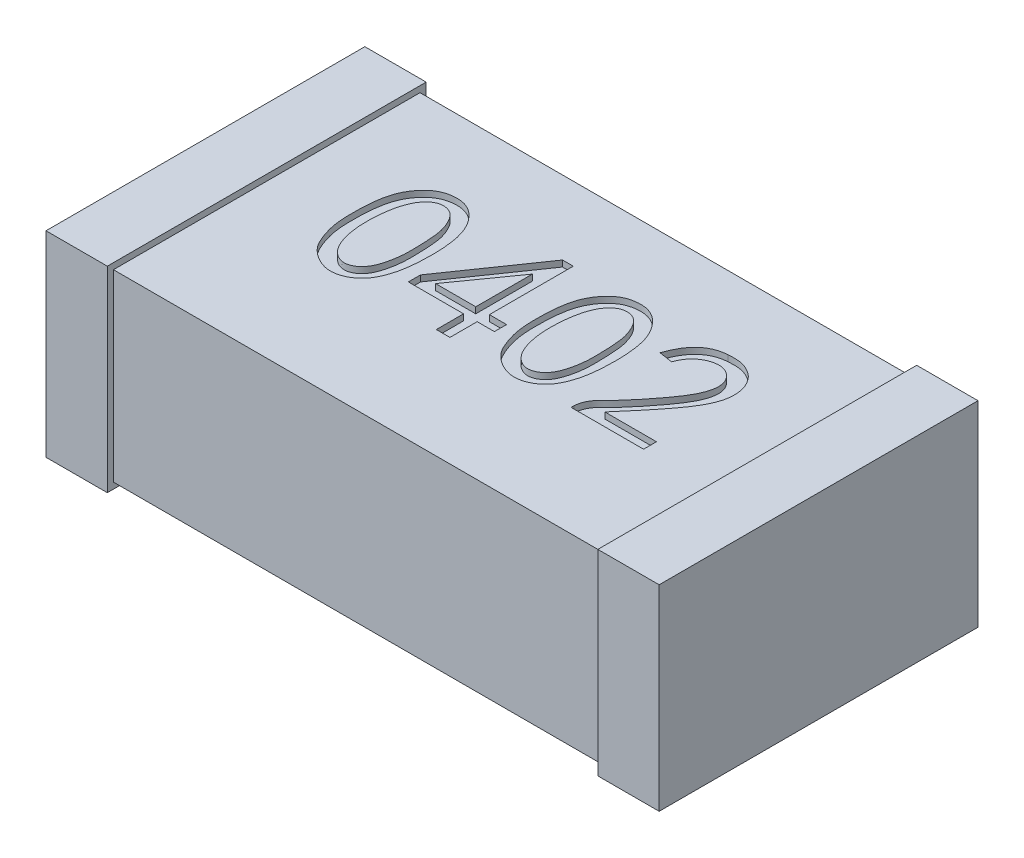
from build123d import *

# Parameters (mm, degrees)
SKETCH_1_W          = 1
SKETCH_1_H          = 0.5
EXTRUDE_1_DEPTH     = 0.3
SKETCH_2_W          = 0.52
SKETCH_2_H          = 0.32
EXTRUDE_2_DEPTH     = 0.1
SKETCH_3_W          = 0.52
SKETCH_3_H          = 0.32
EXTRUDE_3_DEPTH     = 0.1
CUT_EXTRUDE_1_DEPTH = 0.01


with BuildPart() as part:
    # 草图1 → 凸台-拉伸1 (new body)
    with BuildSketch(Plane(origin=(0, 0, 0), x_dir=(1, 0, 0), z_dir=(0, 1, 0))):
        Rectangle(SKETCH_1_W, SKETCH_1_H)
    extrude(amount=EXTRUDE_1_DEPTH)

    # 草图2 → 凸台-拉伸2 (add)
    with BuildSketch(Plane.ZY.offset(0.5)):
        with Locations((0, 0.15)):
            Rectangle(SKETCH_2_W, SKETCH_2_H)
    extrude(amount=-EXTRUDE_2_DEPTH)

    # 草图3 → 凸台-拉伸3 (add)
    with BuildSketch(Plane(origin=(0.5, 0, 0), x_dir=(0, 0, -1), z_dir=(1, 0, 0))):
        with Locations((0, 0.15)):
            Rectangle(SKETCH_3_W, SKETCH_3_H)
    extrude(amount=-EXTRUDE_3_DEPTH)

    # 草图4 → 切除-拉伸1 (cut)
    # profile 1 of 4: a face of its own
    with BuildSketch(Plane(origin=(0, 0.3, 0), x_dir=(1, 0, 0), z_dir=(0, 1, 0))):
        with BuildLine():
            add(Edge.make_bspline(
                [(-0.28495391, 0.040429461), (-0.284842534, 0.042943088), (-0.284625306, 0.047845698), (-0.283997688, 0.054994256), (-0.283239775, 0.061759764), (-0.282254388, 0.068121531), (-0.2810365, 0.074058383), (-0.279658, 0.079601433), (-0.278064926, 0.084735172), (-0.275719159, 0.09100497), (-0.272201568, 0.098221433), (-0.26717004, 0.106152841), (-0.261323237, 0.11328262), (-0.255791975, 0.118506843), (-0.250995997, 0.122183675), (-0.247164102, 0.124570922), (-0.243138334, 0.126610646), (-0.23890549, 0.128274084), (-0.234473356, 0.129513184), (-0.229853673, 0.130427999), (-0.225031193, 0.130993918), (-0.220061865, 0.131162285), (-0.215055093, 0.13092654), (-0.210136656, 0.130158548), (-0.20539045, 0.128795165), (-0.200813235, 0.126923456), (-0.196417467, 0.124518541), (-0.192181018, 0.121599739), (-0.188154114, 0.118091566), (-0.184286565, 0.11413647), (-0.180674162, 0.109783572), (-0.177365208, 0.10511688), (-0.174373449, 0.10018453), (-0.171738764, 0.094959463), (-0.169377081, 0.089487753), (-0.16739584, 0.083720661), (-0.165756704, 0.077681618), (-0.163951759, 0.069150411), (-0.162363798, 0.057833986), (-0.16124506, 0.043511718), (-0.160989781, 0.028240169), (-0.161369896, 0.015033405), (-0.162086421, 0.00433288), (-0.162901031, -0.003428344), (-0.163995193, -0.010794052), (-0.165268928, -0.017800095), (-0.166862448, -0.024409217), (-0.168750785, -0.030628498), (-0.17079105, -0.036498568), (-0.173192551, -0.041957722), (-0.175808163, -0.047052323), (-0.178790184, -0.051717111), (-0.182020787, -0.056015095), (-0.185585612, -0.059912214), (-0.189531103, -0.063329966), (-0.193719991, -0.06643327), (-0.198264771, -0.06907453), (-0.203044338, -0.071315897), (-0.207966932, -0.07309974), (-0.212971097, -0.074262395), (-0.217962432, -0.074953431), (-0.222976111, -0.074955959), (-0.227982428, -0.074520043), (-0.232960824, -0.07337334), (-0.237972706, -0.071796748), (-0.242883828, -0.069567148), (-0.247610668, -0.066999875), (-0.252059884, -0.064236719), (-0.256109885, -0.061230008), (-0.259793032, -0.058019089), (-0.263155271, -0.054630921), (-0.266156922, -0.051033338), (-0.268766829, -0.04721638), (-0.271683353, -0.041844519), (-0.274807882, -0.034915468), (-0.278041751, -0.026380543), (-0.280684804, -0.01764032), (-0.282384341, -0.010129395), (-0.283504843, -0.003845931), (-0.284121346, 0.001304946), (-0.284656871, 0.006849661), (-0.284980527, 0.012789508), (-0.285195813, 0.019129637), (-0.285289508, 0.025874563), (-0.285189223, 0.033023502), (-0.285033733, 0.037917224), (-0.28495391, 0.040429461)],
                knots=[0, 0, 0, 0, 1.18043416, 2.302333746, 3.366253517, 4.374302266, 5.321670991, 6.208995316, 7.053297808, 7.84229274, 9.348259463, 10.810477328, 12.240076564, 13.663562249, 14.3695339, 15.072606272, 15.778577923, 16.484387009, 17.202829605, 17.934942377, 18.692112664, 19.478485278, 20.265441384, 21.040673806, 21.808439453, 22.577161074, 23.356320991, 24.155029842, 24.986154494, 25.858111265, 26.748121484, 27.637306138, 28.540117759, 29.452135788, 30.380885827, 31.334339875, 32.310628684, 33.31521083, 35.42407972, 37.666773946, 40.052062172, 42.587025658, 43.863776122, 45.083322308, 46.247467896, 47.357025429, 48.423487632, 49.435172604, 50.405897663, 51.337337341, 52.231284254, 53.090220275, 53.931690991, 54.751583713, 55.562922169, 56.377338113, 57.194202079, 58.024663732, 58.851830165, 59.645552351, 60.431282623, 61.21044254, 61.99312915, 62.783838437, 63.60230231, 64.454612977, 65.309477934, 66.125301685, 66.909862715, 67.67340185, 68.415973016, 69.147238889, 69.868837108, 70.581506411, 72.0124375, 73.431838244, 74.861437481, 76.292961888, 77.042577341, 77.855187732, 78.726196438, 79.655959089, 80.645695907, 81.702690171, 82.820655125, 84, 84, 84, 84], degree=3))
        make_face()
        with BuildLine():
            add(Edge.make_bspline(
                [(-0.260392506, 0.047447005), (-0.260658041, 0.044806289), (-0.261181153, 0.039603987), (-0.261608995, 0.031886474), (-0.261730918, 0.024387426), (-0.261619269, 0.017103813), (-0.261188699, 0.010049884), (-0.260454073, 0.00321199), (-0.25940762, -0.003405071), (-0.258126854, -0.00978375), (-0.256592321, -0.015822097), (-0.254772487, -0.021438072), (-0.252701077, -0.026590764), (-0.250409612, -0.031287934), (-0.247894284, -0.03553519), (-0.245108254, -0.039308413), (-0.242129687, -0.042687874), (-0.238869569, -0.045527911), (-0.235525843, -0.047912928), (-0.232107256, -0.049766065), (-0.228669562, -0.051079198), (-0.225199642, -0.051882105), (-0.221710001, -0.052138468), (-0.218199248, -0.051890143), (-0.214693353, -0.051023425), (-0.21120973, -0.049695057), (-0.207848325, -0.047865476), (-0.204668318, -0.045656248), (-0.201736014, -0.043017958), (-0.199049862, -0.039978923), (-0.196625221, -0.036520345), (-0.194406719, -0.032701353), (-0.192458705, -0.028458603), (-0.190168009, -0.02224646), (-0.187861059, -0.01397355), (-0.185808628, -0.003635842), (-0.184598054, 0.00714504), (-0.184280654, 0.018206221), (-0.184487027, 0.029196872), (-0.184734546, 0.039843771), (-0.185329713, 0.04996702), (-0.186042011, 0.059618167), (-0.187250846, 0.068840302), (-0.189478567, 0.077585122), (-0.192598951, 0.085876339), (-0.195801688, 0.092421411), (-0.1988711, 0.097172396), (-0.201290789, 0.10036017), (-0.203980867, 0.103023938), (-0.206817398, 0.105294816), (-0.209866366, 0.107023682), (-0.213100198, 0.108316915), (-0.216517483, 0.109118342), (-0.220066431, 0.10951351), (-0.223641875, 0.109444429), (-0.227153824, 0.108816872), (-0.230560059, 0.107719361), (-0.233882012, 0.10615692), (-0.237049987, 0.1040422), (-0.24011462, 0.10145398), (-0.243041387, 0.098348677), (-0.245924442, 0.094810569), (-0.248554289, 0.090702135), (-0.250986432, 0.086099917), (-0.253143291, 0.080944783), (-0.255074981, 0.075266571), (-0.256809826, 0.069065587), (-0.25826848, 0.062338102), (-0.259478906, 0.055078753), (-0.260081031, 0.050048908), (-0.260392506, 0.047447005)],
                knots=[0, 0, 0, 0, 1.378198314, 2.715098627, 4.012594964, 5.272602849, 6.497213731, 7.681415101, 8.842769074, 9.975170128, 11.059162755, 12.076494648, 13.038717388, 13.940857576, 14.788360499, 15.598271168, 16.373595835, 17.122768248, 17.838466736, 18.502782022, 19.136468245, 19.744060339, 20.345653328, 20.947246317, 21.563841626, 22.214212994, 22.87852828, 23.546305104, 24.220743313, 24.921956094, 25.648106704, 26.41081768, 27.212668989, 28.069279432, 29.84713992, 31.666334073, 33.537864714, 35.473745168, 37.408579624, 39.246547954, 41.003985019, 42.674193204, 44.272363647, 45.827394737, 47.348405091, 48.867584295, 49.599750274, 50.283750763, 50.94125936, 51.560811542, 52.165388272, 52.754418158, 53.363720025, 53.982318455, 54.604903792, 55.213928724, 55.828148287, 56.458765578, 57.113918044, 57.800421407, 58.537638978, 59.326979919, 60.167286366, 61.066273245, 62.027297208, 63.065989643, 64.179487018, 65.369443928, 66.639232213, 68, 68, 68, 68], degree=3))
        make_face(mode=Mode.SUBTRACT)
    # profile 2 of 4: a face of its own
    with BuildSketch(Plane(origin=(0, 0.3, 0), x_dir=(1, 0, 0), z_dir=(0, 1, 0))):
        with BuildLine():
            add(Edge.make_bspline(
                [(0.014461295, 0.040429461), (0.01457267, 0.042943088), (0.014789899, 0.047845698), (0.015417517, 0.054994256), (0.01617543, 0.061759764), (0.017160816, 0.068121531), (0.018378705, 0.074058383), (0.019757205, 0.079601433), (0.021350278, 0.084735172), (0.023696046, 0.09100497), (0.027213637, 0.098221433), (0.032245165, 0.106152841), (0.038091968, 0.11328262), (0.04362323, 0.118506843), (0.048419208, 0.122183675), (0.052251103, 0.124570922), (0.056276871, 0.126610646), (0.060509714, 0.128274084), (0.064941849, 0.129513184), (0.069561532, 0.130427999), (0.074384012, 0.130993918), (0.079353339, 0.131162285), (0.084360112, 0.13092654), (0.089278549, 0.130158548), (0.094024754, 0.128795165), (0.09860197, 0.126923456), (0.102997738, 0.124518541), (0.107234186, 0.121599739), (0.111261091, 0.118091566), (0.115128639, 0.11413647), (0.118741043, 0.109783572), (0.122049997, 0.10511688), (0.125041755, 0.10018453), (0.127676441, 0.094959463), (0.130038123, 0.089487753), (0.132019365, 0.083720661), (0.133658501, 0.077681618), (0.135463446, 0.069150411), (0.137051406, 0.057833986), (0.138170145, 0.043511718), (0.138425424, 0.028240169), (0.138045309, 0.015033405), (0.137328784, 0.00433288), (0.136514174, -0.003428344), (0.135420012, -0.010794052), (0.134146277, -0.017800095), (0.132552757, -0.024409217), (0.130664419, -0.030628498), (0.128624155, -0.036498568), (0.126222654, -0.041957722), (0.123607042, -0.047052323), (0.120625021, -0.051717111), (0.117394418, -0.056015095), (0.113829593, -0.059912214), (0.109884101, -0.063329966), (0.105695213, -0.06643327), (0.101150433, -0.06907453), (0.096370866, -0.071315897), (0.091448273, -0.07309974), (0.086444108, -0.074262395), (0.081452772, -0.074953431), (0.076439094, -0.074955959), (0.071432776, -0.074520043), (0.066454381, -0.07337334), (0.061442499, -0.071796748), (0.056531377, -0.069567148), (0.051804537, -0.066999875), (0.047355321, -0.064236719), (0.04330532, -0.061230008), (0.039622173, -0.058019089), (0.036259934, -0.054630921), (0.033258283, -0.051033338), (0.030648376, -0.04721638), (0.027731852, -0.041844519), (0.024607323, -0.034915468), (0.021373453, -0.026380543), (0.0187304, -0.01764032), (0.017030864, -0.010129395), (0.015910361, -0.003845931), (0.015293859, 0.001304946), (0.014758334, 0.006849661), (0.014434678, 0.012789508), (0.014219392, 0.019129637), (0.014125696, 0.025874563), (0.014225981, 0.033023502), (0.014381472, 0.037917224), (0.014461295, 0.040429461)],
                knots=[0, 0, 0, 0, 1.18043416, 2.302333746, 3.366253517, 4.374302266, 5.321670991, 6.208995316, 7.053297808, 7.84229274, 9.348259463, 10.810477328, 12.240076564, 13.663562249, 14.3695339, 15.072606272, 15.778577923, 16.484387009, 17.202829605, 17.934942377, 18.692112664, 19.478485278, 20.265441384, 21.040673806, 21.808439453, 22.577161074, 23.356320991, 24.155029842, 24.986154494, 25.858111265, 26.748121484, 27.637306138, 28.540117759, 29.452135788, 30.380885827, 31.334339875, 32.310628684, 33.31521083, 35.42407972, 37.666773946, 40.052062172, 42.587025658, 43.863776122, 45.083322308, 46.247467896, 47.357025429, 48.423487632, 49.435172604, 50.405897663, 51.337337341, 52.231284254, 53.090220275, 53.931690991, 54.751583713, 55.562922169, 56.377338113, 57.194202079, 58.024663732, 58.851830165, 59.645552351, 60.431282623, 61.21044254, 61.99312915, 62.783838437, 63.60230231, 64.454612977, 65.309477934, 66.125301685, 66.909862715, 67.67340185, 68.415973016, 69.147238889, 69.868837108, 70.581506411, 72.0124375, 73.431838244, 74.861437481, 76.292961888, 77.042577341, 77.855187732, 78.726196438, 79.655959089, 80.645695907, 81.702690171, 82.820655125, 84, 84, 84, 84], degree=3))
        make_face()
        with BuildLine():
            add(Edge.make_bspline(
                [(0.039022698, 0.047447005), (0.038757164, 0.044806289), (0.038234052, 0.039603987), (0.03780621, 0.031886474), (0.037684287, 0.024387426), (0.037795935, 0.017103813), (0.038226506, 0.010049884), (0.038961132, 0.00321199), (0.040007584, -0.003405071), (0.04128835, -0.00978375), (0.042822884, -0.015822097), (0.044642718, -0.021438072), (0.046714127, -0.026590764), (0.049005593, -0.031287934), (0.051520921, -0.03553519), (0.054306951, -0.039308413), (0.057285518, -0.042687874), (0.060545636, -0.045527911), (0.063889362, -0.047912928), (0.067307949, -0.049766065), (0.070745642, -0.051079198), (0.074215563, -0.051882105), (0.077705204, -0.052138468), (0.081215957, -0.051890143), (0.084721852, -0.051023425), (0.088205475, -0.049695057), (0.09156688, -0.047865476), (0.094746886, -0.045656248), (0.097679191, -0.043017958), (0.100365343, -0.039978923), (0.102789983, -0.036520345), (0.105008486, -0.032701353), (0.106956499, -0.028458603), (0.109247196, -0.02224646), (0.111554146, -0.01397355), (0.113606577, -0.003635842), (0.11481715, 0.00714504), (0.11513455, 0.018206221), (0.114928177, 0.029196872), (0.114680659, 0.039843771), (0.114085491, 0.04996702), (0.113373194, 0.059618167), (0.112164359, 0.068840302), (0.109936637, 0.077585122), (0.106816253, 0.085876339), (0.103613517, 0.092421411), (0.100544105, 0.097172396), (0.098124415, 0.10036017), (0.095434338, 0.103023938), (0.092597807, 0.105294816), (0.089548839, 0.107023682), (0.086315006, 0.108316915), (0.082897722, 0.109118342), (0.079348774, 0.10951351), (0.07577333, 0.109444429), (0.072261381, 0.108816872), (0.068855146, 0.107719361), (0.065533192, 0.10615692), (0.062365218, 0.1040422), (0.059300584, 0.10145398), (0.056373817, 0.098348677), (0.053490763, 0.094810569), (0.050860916, 0.090702135), (0.048428772, 0.086099917), (0.046271913, 0.080944783), (0.044340223, 0.075266571), (0.042605379, 0.069065587), (0.041146724, 0.062338102), (0.039936299, 0.055078753), (0.039334173, 0.050048908), (0.039022698, 0.047447005)],
                knots=[0, 0, 0, 0, 1.378198314, 2.715098627, 4.012594964, 5.272602849, 6.497213731, 7.681415101, 8.842769074, 9.975170128, 11.059162755, 12.076494648, 13.038717388, 13.940857576, 14.788360499, 15.598271168, 16.373595835, 17.122768248, 17.838466736, 18.502782022, 19.136468245, 19.744060339, 20.345653328, 20.947246317, 21.563841626, 22.214212994, 22.87852828, 23.546305104, 24.220743313, 24.921956094, 25.648106704, 26.41081768, 27.212668989, 28.069279432, 29.84713992, 31.666334073, 33.537864714, 35.473745168, 37.408579624, 39.246547954, 41.003985019, 42.674193204, 44.272363647, 45.827394737, 47.348405091, 48.867584295, 49.599750274, 50.283750763, 50.94125936, 51.560811542, 52.165388272, 52.754418158, 53.363720025, 53.982318455, 54.604903792, 55.213928724, 55.828148287, 56.458765578, 57.113918044, 57.800421407, 58.537638978, 59.326979919, 60.167286366, 61.066273245, 62.027297208, 63.065989643, 64.179487018, 65.369443928, 66.639232213, 68, 68, 68, 68], degree=3))
        make_face(mode=Mode.SUBTRACT)
    # profile 3 of 4: a face of its own
    with BuildSketch(Plane(origin=(0, 0.3, 0), x_dir=(1, 0, 0), z_dir=(0, 1, 0))):
        Polygon((-0.052205372, -0.026800342), (-0.142263852, -0.026800342), (-0.142263852, -0.006917301), (-0.047527009, 0.129924804), (-0.02998315, 0.129924804), (-0.02998315, -0.006917301), (-0.001912974, -0.006917301), (-0.001912974, -0.026800342), (-0.02998315, -0.026800342), (-0.02998315, -0.071244786), (-0.052205372, -0.071244786), align=None)
        Polygon((-0.052205372, -0.006917301), (-0.052205372, 0.08548036), (-0.117702448, -0.006917301), align=None, mode=Mode.SUBTRACT)
    # profile 4 of 4: a face of its own
    with BuildSketch(Plane(origin=(0, 0.3, 0), x_dir=(1, 0, 0), z_dir=(0, 1, 0))):
        with BuildLine():
            add(Edge.make_bspline(
                [(0.167677669, -0.066566424), (0.167819152, -0.065117686), (0.168100357, -0.062238247), (0.169087783, -0.058002215), (0.170477164, -0.053866347), (0.172305054, -0.049832496), (0.174562028, -0.045899028), (0.177338163, -0.042149222), (0.180438207, -0.038417807), (0.18414559, -0.034890973), (0.188142973, -0.031138417), (0.192283403, -0.02684315), (0.196768062, -0.022153759), (0.201415239, -0.016870399), (0.206421147, -0.011183063), (0.211593233, -0.004923711), (0.217055027, 0.001787941), (0.222653255, 0.008827104), (0.228139326, 0.015897079), (0.233194892, 0.02274894), (0.237792521, 0.029146683), (0.241895109, 0.035112897), (0.245393338, 0.040716313), (0.248431213, 0.045869976), (0.251023326, 0.050564569), (0.253610004, 0.056171474), (0.256051312, 0.062637711), (0.257965559, 0.069983544), (0.258835422, 0.076782014), (0.258493459, 0.083029352), (0.257150599, 0.08873049), (0.254804391, 0.093902754), (0.251511842, 0.098564518), (0.247302315, 0.102541504), (0.242503965, 0.105815746), (0.237164245, 0.108015691), (0.231450795, 0.10912749), (0.225473471, 0.109026902), (0.219448549, 0.107955745), (0.21344644, 0.106093883), (0.207660346, 0.103211019), (0.201991837, 0.099614538), (0.196739911, 0.094981183), (0.192123756, 0.089275398), (0.188196871, 0.082526247), (0.186237739, 0.077540285), (0.185221529, 0.074954044)],
                knots=[0, 0, 0, 0, 0.683264685, 1.358023177, 2.0380809, 2.730345762, 3.435487858, 4.164189287, 4.919895072, 5.711413948, 6.565494804, 7.49616148, 8.513531843, 9.613812574, 10.80147361, 12.073102873, 13.428218159, 14.866997124, 16.298560904, 17.632315587, 18.867297526, 20.000038836, 21.033387935, 21.969994494, 22.810824564, 23.551397478, 24.869445784, 26.052467085, 27.111050094, 28.075902372, 28.975949733, 29.847314516, 30.728213316, 31.639844513, 32.554273251, 33.442456201, 34.333871785, 35.270085163, 36.233696473, 37.201335111, 38.211692251, 39.261697588, 40.347896805, 41.485826765, 42.695887429, 44, 44, 44, 44], degree=3))
            Line((0.185221529, 0.074954044), (0.162999306, 0.078462816))
            add(Edge.make_bspline(
                [(0.162999306, 0.078462816), (0.163783886, 0.080638141), (0.165310338, 0.084870377), (0.167938835, 0.090896877), (0.170654134, 0.096506765), (0.173530765, 0.10166287), (0.176631135, 0.106328389), (0.179880045, 0.11054868), (0.183291973, 0.114323177), (0.186880035, 0.117647465), (0.19063191, 0.120577986), (0.194573362, 0.123119428), (0.198655315, 0.125339446), (0.202893825, 0.127223543), (0.207298046, 0.12874194), (0.211887559, 0.129846138), (0.216615423, 0.130702775), (0.219843824, 0.130962738), (0.221478839, 0.131094395)],
                knots=[0, 0, 0, 0, 1.318688324, 2.565594597, 3.747971738, 4.872722892, 5.930337296, 6.940181326, 7.908044283, 8.828858542, 9.726735078, 10.619953387, 11.500744836, 12.374616489, 13.262770363, 14.15366946, 15.064931369, 16, 16, 16, 16], degree=3))
            add(Edge.make_bspline(
                [(0.221478839, 0.131094395), (0.223383485, 0.131247155), (0.227087653, 0.131544243), (0.232516829, 0.13160018), (0.237640482, 0.131245823), (0.242549268, 0.130572835), (0.247344897, 0.129383147), (0.252150906, 0.127627675), (0.257012747, 0.12525496), (0.261922511, 0.122344797), (0.266735232, 0.11878234), (0.271092401, 0.114302744), (0.274937422, 0.108992737), (0.278372852, 0.10298583), (0.281145799, 0.096232252), (0.282813449, 0.088709786), (0.283424975, 0.080549698), (0.283088959, 0.073351955), (0.282270444, 0.067261307), (0.281123615, 0.062393549), (0.279470841, 0.057326202), (0.277524882, 0.051980782), (0.27494086, 0.046484051), (0.272032358, 0.040718017), (0.268554248, 0.034787217), (0.265397889, 0.0296633), (0.262538193, 0.025397057), (0.260142948, 0.021915772), (0.257526276, 0.018199662), (0.25458928, 0.014307812), (0.25148744, 0.010150987), (0.248150871, 0.005765095), (0.244550529, 0.00118816), (0.240728062, -0.003637828), (0.236666209, -0.008699998), (0.232346638, -0.013969016), (0.227770542, -0.01943303), (0.223009132, -0.025166085), (0.218004429, -0.031120127), (0.2127526, -0.037289547), (0.207236301, -0.043646543), (0.203500501, -0.047981811), (0.201595798, -0.050192155)],
                knots=[0, 0, 0, 0, 0.924262298, 1.797511285, 2.623724224, 3.407158757, 4.191620419, 5.009283641, 5.877881841, 6.805175164, 7.767818098, 8.765683208, 9.814991193, 10.931884262, 12.107176208, 13.332417047, 14.642951659, 16.055476784, 16.810263112, 17.613474593, 18.470705512, 19.388078144, 20.363412498, 21.406914204, 22.511682051, 23.688322701, 24.318011351, 24.996206783, 25.732766533, 26.516574724, 27.354866926, 28.242087009, 29.182574856, 30.172115786, 31.220563025, 32.322544456, 33.468316952, 34.668650042, 35.928027342, 37.231299145, 38.588373428, 40, 40, 40, 40], degree=3))
            Line((0.201595798, -0.050192155), (0.285806324, -0.050192155))
            Line((0.285806324, -0.050192155), (0.285806324, -0.071244786))
            Line((0.285806324, -0.071244786), (0.167677669, -0.071244786))
            Line((0.167677669, -0.071244786), (0.167677669, -0.066566424))
        make_face()
    extrude(amount=-CUT_EXTRUDE_1_DEPTH, mode=Mode.SUBTRACT)


solid = part.part
